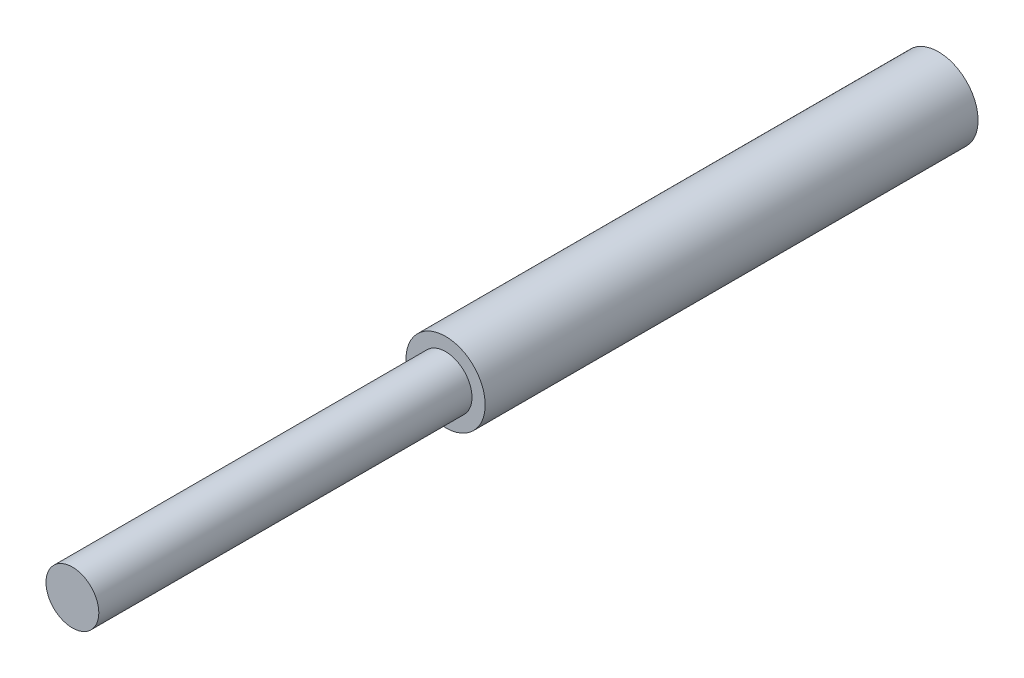
from build123d import *

# Parameters (mm, degrees)
SKETCH1_R           = 1.5
BOSS_EXTRUDE1_DEPTH = 21.2
SKETCH2_R           = 2.25
BOSS_EXTRUDE2_DEPTH = 28
SKETCH3_R           = 1.5
CUT_EXTRUDE1_DEPTH  = 6


with BuildPart() as part:
    # Sketch1 → Boss-Extrude1 (new body)
    with BuildSketch(Plane.XY):
        Circle(SKETCH1_R)
    extrude(amount=BOSS_EXTRUDE1_DEPTH)

    # Sketch2 → Boss-Extrude2 (add)
    with BuildSketch(Plane(origin=(0, 0, 0), x_dir=(-1, 0, 0), z_dir=(0, 0, -1))):
        Circle(SKETCH2_R)
    extrude(amount=BOSS_EXTRUDE2_DEPTH)

    # Sketch3 → Cut-Extrude1 (cut)
    with BuildSketch(Plane(origin=(0, 0, -28), x_dir=(-1, 0, 0), z_dir=(0, 0, -1))):
        Circle(SKETCH3_R)
    extrude(amount=-CUT_EXTRUDE1_DEPTH, mode=Mode.SUBTRACT)


solid = part.part
